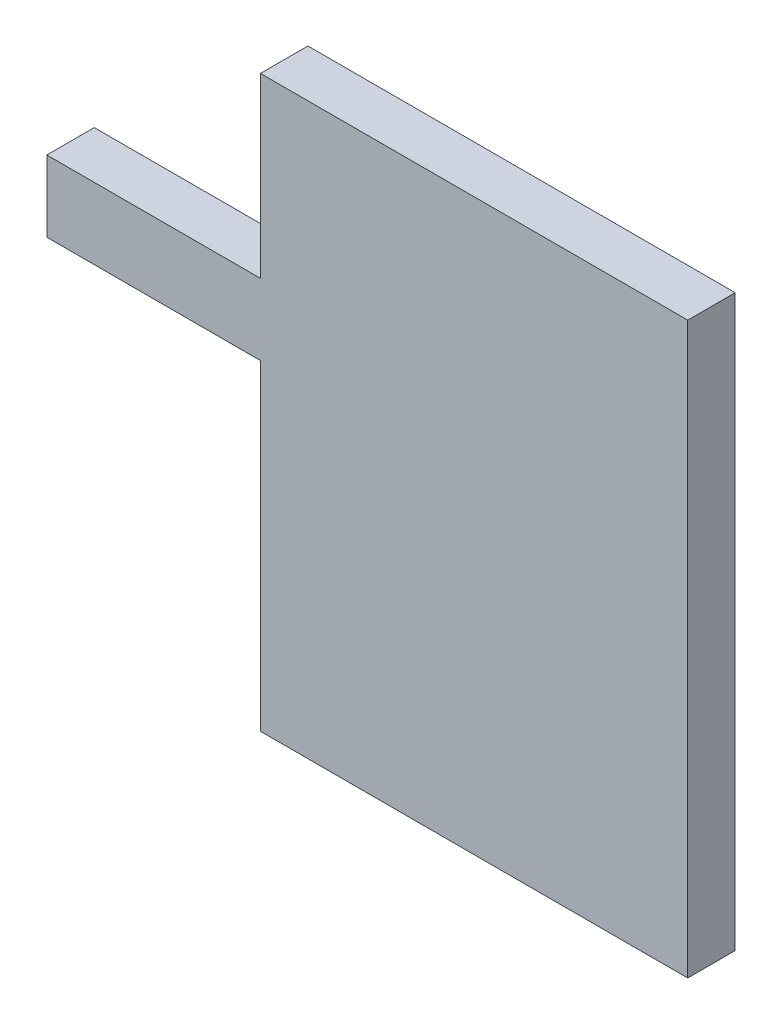
from build123d import *

# Parameters (mm, degrees)
BOSS_EXTRUDE1_DEPTH = 10


with BuildPart() as part:
    # Sketch1 → Boss-Extrude1 (new body)
    with BuildSketch(Plane.XY):
        Polygon((-57.346581188, 74.840703022), (32.653418812, 74.840703022), (32.653418812, -45.159296978), (-57.346581188, -45.159296978), (-57.346581188, 22.460703022), (-102.346581188, 22.460703022), (-102.346581188, 37.460703022), (-57.346581188, 37.460703022), align=None)
    extrude(amount=BOSS_EXTRUDE1_DEPTH)


solid = part.part
